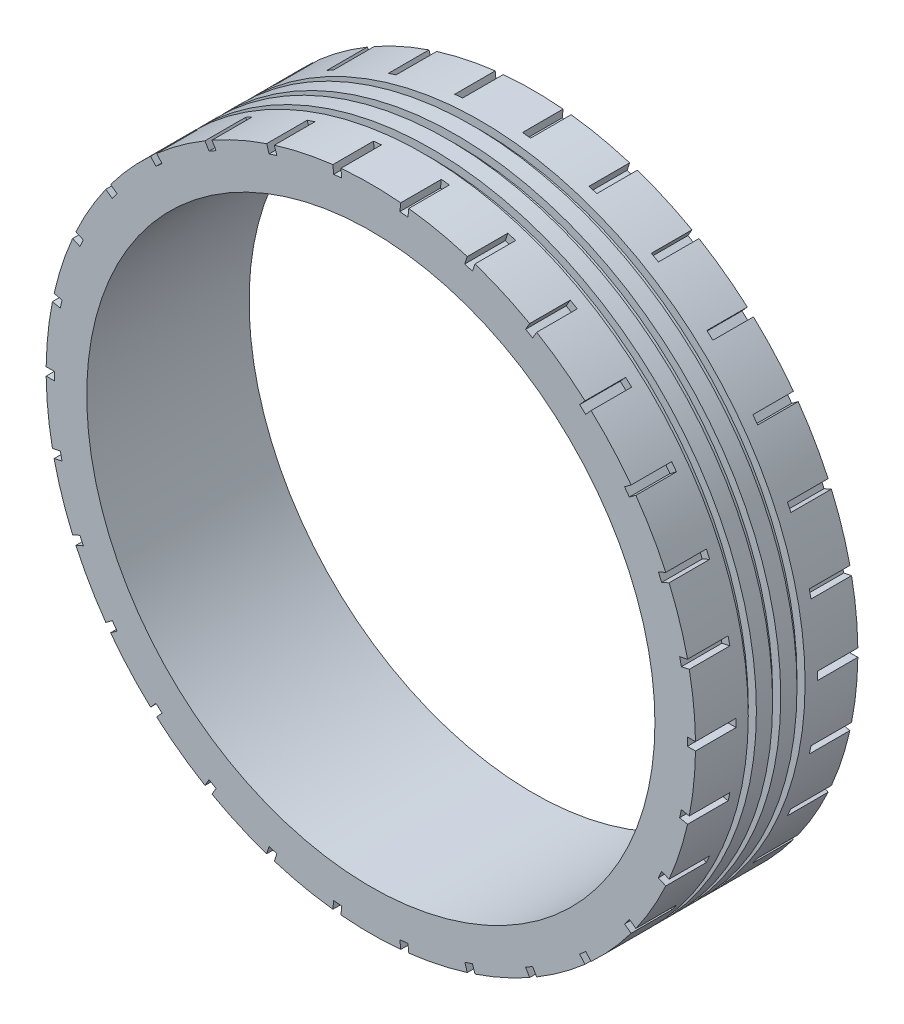
from build123d import *

# Parameters (mm, degrees)
SKETCH_1_R                 = 40
SKETCH_1_R_2               = 35
EXTRUDE_1_DEPTH            = 20
SKETCH_2_W                 = 2
SKETCH_2_H                 = 1
CUT_EXTRUDE_1_DEPTH        = 5
PATTERN_CIRCULAR_1_COUNT   = 30
MIRROR_1_COPY_1_SKETCH_W   = 2
MIRROR_1_COPY_1_SKETCH_H   = 1
MIRROR_1_COPY_1_DEPTH      = 5
MIRROR_1_COPY_2_SKETCH_W   = 2
MIRROR_1_COPY_2_SKETCH_H   = 1
MIRROR_1_COPY_2_DEPTH      = 5
MIRROR_1_COPY_3_SKETCH_W   = 2
MIRROR_1_COPY_3_SKETCH_H   = 1
MIRROR_1_COPY_3_DEPTH      = 5
MIRROR_1_COPY_4_SKETCH_W   = 2
MIRROR_1_COPY_4_SKETCH_H   = 1
MIRROR_1_COPY_4_DEPTH      = 5
MIRROR_1_COPY_5_SKETCH_W   = 2
MIRROR_1_COPY_5_SKETCH_H   = 1
MIRROR_1_COPY_5_DEPTH      = 5
MIRROR_1_COPY_6_SKETCH_W   = 2
MIRROR_1_COPY_6_SKETCH_H   = 1
MIRROR_1_COPY_6_DEPTH      = 5
MIRROR_1_COPY_7_SKETCH_W   = 2
MIRROR_1_COPY_7_SKETCH_H   = 1
MIRROR_1_COPY_7_DEPTH      = 5
MIRROR_1_COPY_8_SKETCH_W   = 2
MIRROR_1_COPY_8_SKETCH_H   = 1
MIRROR_1_COPY_8_DEPTH      = 5
MIRROR_1_COPY_9_SKETCH_W   = 2
MIRROR_1_COPY_9_SKETCH_H   = 1
MIRROR_1_COPY_9_DEPTH      = 5
MIRROR_1_COPY_10_SKETCH_W  = 2
MIRROR_1_COPY_10_SKETCH_H  = 1
MIRROR_1_COPY_10_DEPTH     = 5
MIRROR_1_COPY_11_SKETCH_W  = 2
MIRROR_1_COPY_11_SKETCH_H  = 1
MIRROR_1_COPY_11_DEPTH     = 5
MIRROR_1_COPY_12_SKETCH_W  = 2
MIRROR_1_COPY_12_SKETCH_H  = 1
MIRROR_1_COPY_12_DEPTH     = 5
MIRROR_1_COPY_13_SKETCH_W  = 2
MIRROR_1_COPY_13_SKETCH_H  = 1
MIRROR_1_COPY_13_DEPTH     = 5
MIRROR_1_COPY_14_SKETCH_W  = 2
MIRROR_1_COPY_14_SKETCH_H  = 1
MIRROR_1_COPY_14_DEPTH     = 5
MIRROR_1_COPY_15_SKETCH_W  = 2
MIRROR_1_COPY_15_SKETCH_H  = 1
MIRROR_1_COPY_15_DEPTH     = 5
MIRROR_1_COPY_16_SKETCH_W  = 2
MIRROR_1_COPY_16_SKETCH_H  = 1
MIRROR_1_COPY_16_DEPTH     = 5
MIRROR_1_COPY_17_SKETCH_W  = 2
MIRROR_1_COPY_17_SKETCH_H  = 1
MIRROR_1_COPY_17_DEPTH     = 5
MIRROR_1_COPY_18_SKETCH_W  = 2
MIRROR_1_COPY_18_SKETCH_H  = 1
MIRROR_1_COPY_18_DEPTH     = 5
MIRROR_1_COPY_19_SKETCH_W  = 2
MIRROR_1_COPY_19_SKETCH_H  = 1
MIRROR_1_COPY_19_DEPTH     = 5
MIRROR_1_COPY_20_SKETCH_W  = 2
MIRROR_1_COPY_20_SKETCH_H  = 1
MIRROR_1_COPY_20_DEPTH     = 5
MIRROR_1_COPY_21_SKETCH_W  = 2
MIRROR_1_COPY_21_SKETCH_H  = 1
MIRROR_1_COPY_21_DEPTH     = 5
MIRROR_1_COPY_22_SKETCH_W  = 2
MIRROR_1_COPY_22_SKETCH_H  = 1
MIRROR_1_COPY_22_DEPTH     = 5
MIRROR_1_COPY_23_SKETCH_W  = 2
MIRROR_1_COPY_23_SKETCH_H  = 1
MIRROR_1_COPY_23_DEPTH     = 5
MIRROR_1_COPY_24_SKETCH_W  = 2
MIRROR_1_COPY_24_SKETCH_H  = 1
MIRROR_1_COPY_24_DEPTH     = 5
MIRROR_1_COPY_25_SKETCH_W  = 2
MIRROR_1_COPY_25_SKETCH_H  = 1
MIRROR_1_COPY_25_DEPTH     = 5
MIRROR_1_COPY_26_SKETCH_W  = 2
MIRROR_1_COPY_26_SKETCH_H  = 1
MIRROR_1_COPY_26_DEPTH     = 5
MIRROR_1_COPY_27_SKETCH_W  = 2
MIRROR_1_COPY_27_SKETCH_H  = 1
MIRROR_1_COPY_27_DEPTH     = 5
MIRROR_1_COPY_28_SKETCH_W  = 2
MIRROR_1_COPY_28_SKETCH_H  = 1
MIRROR_1_COPY_28_DEPTH     = 5
MIRROR_1_COPY_29_SKETCH_W  = 2
MIRROR_1_COPY_29_SKETCH_H  = 1
MIRROR_1_COPY_29_DEPTH     = 5
SKETCH_4_R                 = 45
SKETCH_4_R_2               = 39.003204997
CUT_EXTRUDE_2_DEPTH        = 0.5
PATTERN_LINEAR_1_COUNT     = 2
PATTERN_LINEAR_1_PITCH     = 3
PATTERN_LINEAR_1_COL_COUNT = 2
PATTERN_LINEAR_1_COL_PITCH = 3


with BuildPart() as part:
    # 草图1 → 凸台-拉伸1 (new body)
    with BuildSketch(Plane.XY):
        Circle(SKETCH_1_R)
        Circle(SKETCH_1_R_2, mode=Mode.SUBTRACT)
    extrude(amount=EXTRUDE_1_DEPTH)

    # 草图2 → 切除-拉伸1 (cut)
    with BuildSketch(Plane(origin=(0, 0, 0), x_dir=(-1, 0, 0), z_dir=(0, 0, -1))):
        with Locations((40, 0)):
            Rectangle(SKETCH_2_W, SKETCH_2_H)
    cut_extrude_1 = extrude(amount=-CUT_EXTRUDE_1_DEPTH, mode=Mode.SUBTRACT)

    # 阵列(圆周)1: 切除-拉伸1 ×30 about axis
    pattern_circular_1_axis = Axis((0, 0, 0), (0, 0, 1))
    for i in range(1, PATTERN_CIRCULAR_1_COUNT):
        add(cut_extrude_1.rotate(pattern_circular_1_axis, i * 360 / PATTERN_CIRCULAR_1_COUNT), mode=Mode.SUBTRACT)

    # 镜向1: 切除-拉伸1 across plane
    add(cut_extrude_1.mirror(Plane.XY.offset(10)), mode=Mode.SUBTRACT)

    # 镜向1 copy 1 sketch → 镜向1 copy 1 (cut)
    with BuildSketch(Plane(origin=(0, 0, 20), x_dir=(-0.9781476007338057, -0.20791169081775934, 0), z_dir=(0, 0, 1))):
        with Locations((40, 0)):
            Rectangle(MIRROR_1_COPY_1_SKETCH_W, MIRROR_1_COPY_1_SKETCH_H)
    extrude(amount=-MIRROR_1_COPY_1_DEPTH, mode=Mode.SUBTRACT)

    # 镜向1 copy 2 sketch → 镜向1 copy 2 (cut)
    with BuildSketch(Plane(origin=(0, 0, 20), x_dir=(-0.9135454576426009, -0.4067366430758002, 0), z_dir=(0, 0, 1))):
        with Locations((40, 0)):
            Rectangle(MIRROR_1_COPY_2_SKETCH_W, MIRROR_1_COPY_2_SKETCH_H)
    extrude(amount=-MIRROR_1_COPY_2_DEPTH, mode=Mode.SUBTRACT)

    # 镜向1 copy 3 sketch → 镜向1 copy 3 (cut)
    with BuildSketch(Plane(origin=(0, 0, 20), x_dir=(-0.8090169943749475, -0.5877852522924731, 0), z_dir=(0, 0, 1))):
        with Locations((40, 0)):
            Rectangle(MIRROR_1_COPY_3_SKETCH_W, MIRROR_1_COPY_3_SKETCH_H)
    extrude(amount=-MIRROR_1_COPY_3_DEPTH, mode=Mode.SUBTRACT)

    # 镜向1 copy 4 sketch → 镜向1 copy 4 (cut)
    with BuildSketch(Plane(origin=(0, 0, 20), x_dir=(-0.6691306063588582, -0.7431448254773942, 0), z_dir=(0, 0, 1))):
        with Locations((40, 0)):
            Rectangle(MIRROR_1_COPY_4_SKETCH_W, MIRROR_1_COPY_4_SKETCH_H)
    extrude(amount=-MIRROR_1_COPY_4_DEPTH, mode=Mode.SUBTRACT)

    # 镜向1 copy 5 sketch → 镜向1 copy 5 (cut)
    with BuildSketch(Plane(origin=(0, 0, 20), x_dir=(-0.5000000000000001, -0.8660254037844386, 0), z_dir=(0, 0, 1))):
        with Locations((40, 0)):
            Rectangle(MIRROR_1_COPY_5_SKETCH_W, MIRROR_1_COPY_5_SKETCH_H)
    extrude(amount=-MIRROR_1_COPY_5_DEPTH, mode=Mode.SUBTRACT)

    # 镜向1 copy 6 sketch → 镜向1 copy 6 (cut)
    with BuildSketch(Plane(origin=(0, 0, 20), x_dir=(-0.30901699437494745, -0.9510565162951535, 0), z_dir=(0, 0, 1))):
        with Locations((40, 0)):
            Rectangle(MIRROR_1_COPY_6_SKETCH_W, MIRROR_1_COPY_6_SKETCH_H)
    extrude(amount=-MIRROR_1_COPY_6_DEPTH, mode=Mode.SUBTRACT)

    # 镜向1 copy 7 sketch → 镜向1 copy 7 (cut)
    with BuildSketch(Plane(origin=(0, 0, 20), x_dir=(-0.10452846326765346, -0.9945218953682733, 0), z_dir=(0, 0, 1))):
        with Locations((40, 0)):
            Rectangle(MIRROR_1_COPY_7_SKETCH_W, MIRROR_1_COPY_7_SKETCH_H)
    extrude(amount=-MIRROR_1_COPY_7_DEPTH, mode=Mode.SUBTRACT)

    # 镜向1 copy 8 sketch → 镜向1 copy 8 (cut)
    with BuildSketch(Plane(origin=(0, 0, 20), x_dir=(0.10452846326765355, -0.9945218953682733, 0), z_dir=(0, 0, 1))):
        with Locations((40, 0)):
            Rectangle(MIRROR_1_COPY_8_SKETCH_W, MIRROR_1_COPY_8_SKETCH_H)
    extrude(amount=-MIRROR_1_COPY_8_DEPTH, mode=Mode.SUBTRACT)

    # 镜向1 copy 9 sketch → 镜向1 copy 9 (cut)
    with BuildSketch(Plane(origin=(0, 0, 20), x_dir=(0.30901699437494734, -0.9510565162951536, 0), z_dir=(0, 0, 1))):
        with Locations((40, 0)):
            Rectangle(MIRROR_1_COPY_9_SKETCH_W, MIRROR_1_COPY_9_SKETCH_H)
    extrude(amount=-MIRROR_1_COPY_9_DEPTH, mode=Mode.SUBTRACT)

    # 镜向1 copy 10 sketch → 镜向1 copy 10 (cut)
    with BuildSketch(Plane(origin=(0, 0, 20), x_dir=(0.4999999999999998, -0.8660254037844387, 0), z_dir=(0, 0, 1))):
        with Locations((40, 0)):
            Rectangle(MIRROR_1_COPY_10_SKETCH_W, MIRROR_1_COPY_10_SKETCH_H)
    extrude(amount=-MIRROR_1_COPY_10_DEPTH, mode=Mode.SUBTRACT)

    # 镜向1 copy 11 sketch → 镜向1 copy 11 (cut)
    with BuildSketch(Plane(origin=(0, 0, 20), x_dir=(0.6691306063588582, -0.7431448254773942, 0), z_dir=(0, 0, 1))):
        with Locations((40, 0)):
            Rectangle(MIRROR_1_COPY_11_SKETCH_W, MIRROR_1_COPY_11_SKETCH_H)
    extrude(amount=-MIRROR_1_COPY_11_DEPTH, mode=Mode.SUBTRACT)

    # 镜向1 copy 12 sketch → 镜向1 copy 12 (cut)
    with BuildSketch(Plane(origin=(0, 0, 20), x_dir=(0.8090169943749473, -0.5877852522924732, 0), z_dir=(0, 0, 1))):
        with Locations((40, 0)):
            Rectangle(MIRROR_1_COPY_12_SKETCH_W, MIRROR_1_COPY_12_SKETCH_H)
    extrude(amount=-MIRROR_1_COPY_12_DEPTH, mode=Mode.SUBTRACT)

    # 镜向1 copy 13 sketch → 镜向1 copy 13 (cut)
    with BuildSketch(Plane(origin=(0, 0, 20), x_dir=(0.9135454576426008, -0.40673664307580043, 0), z_dir=(0, 0, 1))):
        with Locations((40, 0)):
            Rectangle(MIRROR_1_COPY_13_SKETCH_W, MIRROR_1_COPY_13_SKETCH_H)
    extrude(amount=-MIRROR_1_COPY_13_DEPTH, mode=Mode.SUBTRACT)

    # 镜向1 copy 14 sketch → 镜向1 copy 14 (cut)
    with BuildSketch(Plane(origin=(0, 0, 20), x_dir=(0.9781476007338057, -0.20791169081775931, 0), z_dir=(0, 0, 1))):
        with Locations((40, 0)):
            Rectangle(MIRROR_1_COPY_14_SKETCH_W, MIRROR_1_COPY_14_SKETCH_H)
    extrude(amount=-MIRROR_1_COPY_14_DEPTH, mode=Mode.SUBTRACT)

    # 镜向1 copy 15 sketch → 镜向1 copy 15 (cut)
    with BuildSketch(Plane.XY.offset(20)):
        with Locations((40, 0)):
            Rectangle(MIRROR_1_COPY_15_SKETCH_W, MIRROR_1_COPY_15_SKETCH_H)
    extrude(amount=-MIRROR_1_COPY_15_DEPTH, mode=Mode.SUBTRACT)

    # 镜向1 copy 16 sketch → 镜向1 copy 16 (cut)
    with BuildSketch(Plane(origin=(0, 0, 20), x_dir=(0.9781476007338056, 0.2079116908177595, 0), z_dir=(0, 0, 1))):
        with Locations((40, 0)):
            Rectangle(MIRROR_1_COPY_16_SKETCH_W, MIRROR_1_COPY_16_SKETCH_H)
    extrude(amount=-MIRROR_1_COPY_16_DEPTH, mode=Mode.SUBTRACT)

    # 镜向1 copy 17 sketch → 镜向1 copy 17 (cut)
    with BuildSketch(Plane(origin=(0, 0, 20), x_dir=(0.9135454576426009, 0.4067366430758002, 0), z_dir=(0, 0, 1))):
        with Locations((40, 0)):
            Rectangle(MIRROR_1_COPY_17_SKETCH_W, MIRROR_1_COPY_17_SKETCH_H)
    extrude(amount=-MIRROR_1_COPY_17_DEPTH, mode=Mode.SUBTRACT)

    # 镜向1 copy 18 sketch → 镜向1 copy 18 (cut)
    with BuildSketch(Plane(origin=(0, 0, 20), x_dir=(0.8090169943749476, 0.587785252292473, 0), z_dir=(0, 0, 1))):
        with Locations((40, 0)):
            Rectangle(MIRROR_1_COPY_18_SKETCH_W, MIRROR_1_COPY_18_SKETCH_H)
    extrude(amount=-MIRROR_1_COPY_18_DEPTH, mode=Mode.SUBTRACT)

    # 镜向1 copy 19 sketch → 镜向1 copy 19 (cut)
    with BuildSketch(Plane(origin=(0, 0, 20), x_dir=(0.6691306063588581, 0.7431448254773944, 0), z_dir=(0, 0, 1))):
        with Locations((40, 0)):
            Rectangle(MIRROR_1_COPY_19_SKETCH_W, MIRROR_1_COPY_19_SKETCH_H)
    extrude(amount=-MIRROR_1_COPY_19_DEPTH, mode=Mode.SUBTRACT)

    # 镜向1 copy 20 sketch → 镜向1 copy 20 (cut)
    with BuildSketch(Plane(origin=(0, 0, 20), x_dir=(0.5000000000000004, 0.8660254037844384, 0), z_dir=(0, 0, 1))):
        with Locations((40, 0)):
            Rectangle(MIRROR_1_COPY_20_SKETCH_W, MIRROR_1_COPY_20_SKETCH_H)
    extrude(amount=-MIRROR_1_COPY_20_DEPTH, mode=Mode.SUBTRACT)

    # 镜向1 copy 21 sketch → 镜向1 copy 21 (cut)
    with BuildSketch(Plane(origin=(0, 0, 20), x_dir=(0.30901699437494756, 0.9510565162951535, 0), z_dir=(0, 0, 1))):
        with Locations((40, 0)):
            Rectangle(MIRROR_1_COPY_21_SKETCH_W, MIRROR_1_COPY_21_SKETCH_H)
    extrude(amount=-MIRROR_1_COPY_21_DEPTH, mode=Mode.SUBTRACT)

    # 镜向1 copy 22 sketch → 镜向1 copy 22 (cut)
    with BuildSketch(Plane(origin=(0, 0, 20), x_dir=(0.10452846326765336, 0.9945218953682734, 0), z_dir=(0, 0, 1))):
        with Locations((40, 0)):
            Rectangle(MIRROR_1_COPY_22_SKETCH_W, MIRROR_1_COPY_22_SKETCH_H)
    extrude(amount=-MIRROR_1_COPY_22_DEPTH, mode=Mode.SUBTRACT)

    # 镜向1 copy 23 sketch → 镜向1 copy 23 (cut)
    with BuildSketch(Plane(origin=(0, 0, 20), x_dir=(-0.10452846326765299, 0.9945218953682734, 0), z_dir=(0, 0, 1))):
        with Locations((40, 0)):
            Rectangle(MIRROR_1_COPY_23_SKETCH_W, MIRROR_1_COPY_23_SKETCH_H)
    extrude(amount=-MIRROR_1_COPY_23_DEPTH, mode=Mode.SUBTRACT)

    # 镜向1 copy 24 sketch → 镜向1 copy 24 (cut)
    with BuildSketch(Plane(origin=(0, 0, 20), x_dir=(-0.30901699437494723, 0.9510565162951536, 0), z_dir=(0, 0, 1))):
        with Locations((40, 0)):
            Rectangle(MIRROR_1_COPY_24_SKETCH_W, MIRROR_1_COPY_24_SKETCH_H)
    extrude(amount=-MIRROR_1_COPY_24_DEPTH, mode=Mode.SUBTRACT)

    # 镜向1 copy 25 sketch → 镜向1 copy 25 (cut)
    with BuildSketch(Plane(origin=(0, 0, 20), x_dir=(-0.5000000000000001, 0.8660254037844386, 0), z_dir=(0, 0, 1))):
        with Locations((40, 0)):
            Rectangle(MIRROR_1_COPY_25_SKETCH_W, MIRROR_1_COPY_25_SKETCH_H)
    extrude(amount=-MIRROR_1_COPY_25_DEPTH, mode=Mode.SUBTRACT)

    # 镜向1 copy 26 sketch → 镜向1 copy 26 (cut)
    with BuildSketch(Plane(origin=(0, 0, 20), x_dir=(-0.6691306063588578, 0.7431448254773946, 0), z_dir=(0, 0, 1))):
        with Locations((40, 0)):
            Rectangle(MIRROR_1_COPY_26_SKETCH_W, MIRROR_1_COPY_26_SKETCH_H)
    extrude(amount=-MIRROR_1_COPY_26_DEPTH, mode=Mode.SUBTRACT)

    # 镜向1 copy 27 sketch → 镜向1 copy 27 (cut)
    with BuildSketch(Plane(origin=(0, 0, 20), x_dir=(-0.8090169943749473, 0.5877852522924734, 0), z_dir=(0, 0, 1))):
        with Locations((40, 0)):
            Rectangle(MIRROR_1_COPY_27_SKETCH_W, MIRROR_1_COPY_27_SKETCH_H)
    extrude(amount=-MIRROR_1_COPY_27_DEPTH, mode=Mode.SUBTRACT)

    # 镜向1 copy 28 sketch → 镜向1 copy 28 (cut)
    with BuildSketch(Plane(origin=(0, 0, 20), x_dir=(-0.913545457642601, 0.40673664307580015, 0), z_dir=(0, 0, 1))):
        with Locations((40, 0)):
            Rectangle(MIRROR_1_COPY_28_SKETCH_W, MIRROR_1_COPY_28_SKETCH_H)
    extrude(amount=-MIRROR_1_COPY_28_DEPTH, mode=Mode.SUBTRACT)

    # 镜向1 copy 29 sketch → 镜向1 copy 29 (cut)
    with BuildSketch(Plane(origin=(0, 0, 20), x_dir=(-0.9781476007338056, 0.20791169081775987, 0), z_dir=(0, 0, 1))):
        with Locations((40, 0)):
            Rectangle(MIRROR_1_COPY_29_SKETCH_W, MIRROR_1_COPY_29_SKETCH_H)
    extrude(amount=-MIRROR_1_COPY_29_DEPTH, mode=Mode.SUBTRACT)

    # 草图4 → 切除-拉伸2 (cut, symmetric)
    with BuildSketch(Plane.XY.offset(10)):
        Circle(SKETCH_4_R)
        Circle(SKETCH_4_R_2, mode=Mode.SUBTRACT)
    cut_extrude_2 = extrude(amount=CUT_EXTRUDE_2_DEPTH, both=True, mode=Mode.SUBTRACT)

    # 阵列(线性)1: 切除-拉伸2 ×2
    with Locations(*[(0, 0, i * PATTERN_LINEAR_1_PITCH) for i in range(1, PATTERN_LINEAR_1_COUNT)]):
        add(cut_extrude_2, mode=Mode.SUBTRACT)

    # 阵列(线性)1 col: 切除-拉伸2 ×2
    with Locations(*[(0, 0, -i * PATTERN_LINEAR_1_COL_PITCH) for i in range(1, PATTERN_LINEAR_1_COL_COUNT)]):
        add(cut_extrude_2, mode=Mode.SUBTRACT)


solid = part.part
